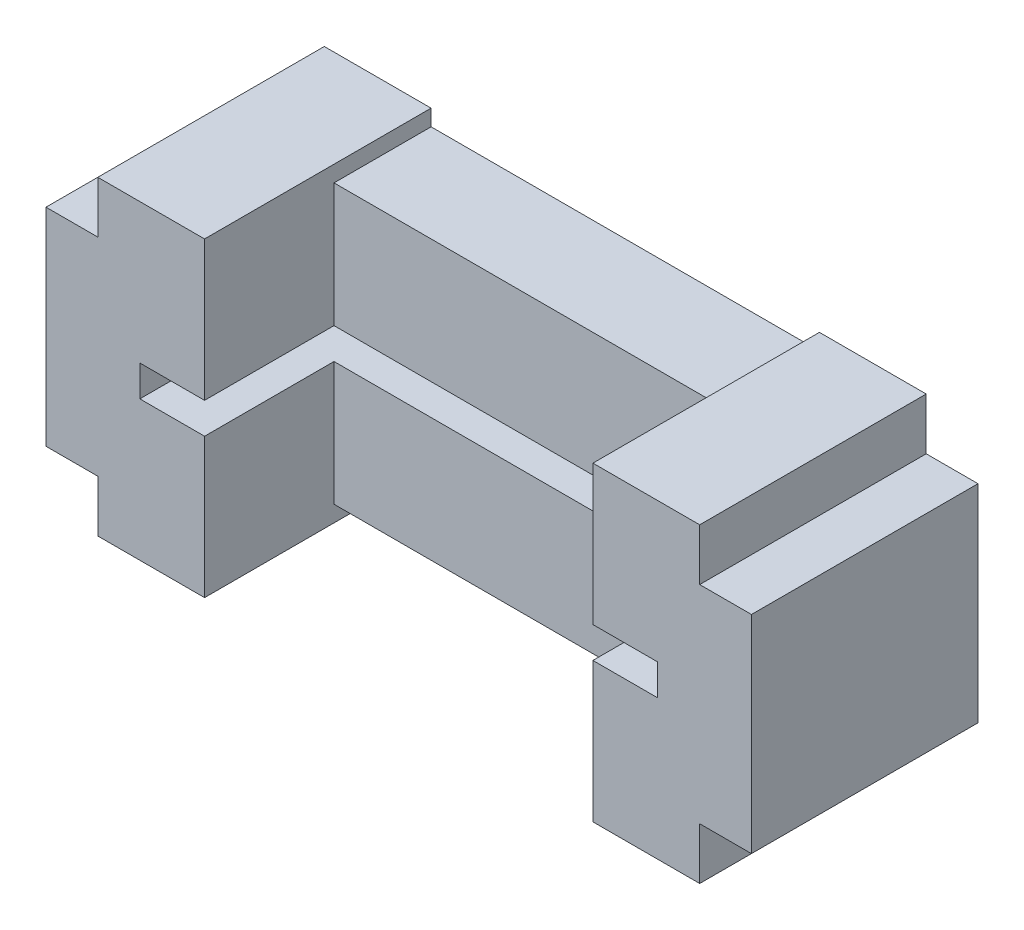
from build123d import *

# Parameters (mm, degrees)
BOSS_EXTRUDE1_DEPTH     = 9.525
BOSS_EXTRUDE2_DEPTH     = 12.7
SKETCH4_W               = 50.8
SKETCH4_H               = 3.048
CUT_EXTRUDE1_DEPTH      = 6.096
CUT_EXTRUDE2_DEPTH      = 40.890182454
CUT_EXTRUDE2_DEPTH_BACK = 40.890182454
SKETCH5_W               = 38.1
SKETCH5_H               = 1.5875


with BuildPart() as part:
    # Sketch1 → Boss-Extrude1 (new body)
    with BuildSketch(Plane.XY):
        Polygon((-29.5275, -15.24), (29.5275, -15.24), (29.5275, -10.16), (34.6075, -10.16), (34.6075, 10.16), (29.5275, 10.16), (29.5275, 15.24), (-29.5275, 15.24), (-29.5275, 10.16), (-34.6075, 10.16), (-34.6075, -10.16), (-29.5275, -10.16), align=None)
    extrude(amount=BOSS_EXTRUDE1_DEPTH)

    # Sketch3 → Boss-Extrude2 (add)
    with BuildSketch(Plane.XY.offset(9.525)):
        Polygon((-29.5275, 15.24), (-19.05, 15.24), (-19.05, 1.524), (-25.4, 1.524), (-25.4, -1.524), (-19.05, -1.524), (-19.05, -15.24), (-29.5275, -15.24), (-29.5275, -10.16), (-34.6075, -10.16), (-34.6075, 10.16), (-29.5275, 10.16), align=None)
        Polygon((19.05, -1.524), (19.05, -15.24), (29.5275, -15.24), (29.5275, -10.16), (34.6075, -10.16), (34.6075, 10.16), (29.5275, 10.16), (29.5275, 15.24), (19.05, 15.24), (19.05, 1.524), (25.4, 1.524), (25.4, -1.524), align=None)
    extrude(amount=BOSS_EXTRUDE2_DEPTH)

    # Sketch4 → Cut-Extrude1 (cut)
    with BuildSketch(Plane.XY.offset(9.525)):
        Rectangle(SKETCH4_W, SKETCH4_H)
    extrude(amount=-CUT_EXTRUDE1_DEPTH, mode=Mode.SUBTRACT)

    # Sketch5 → Cut-Extrude2 (cut, two sides: drawn at the far end of the back side and taken through both)
    with BuildSketch(Plane.XY.offset(9.525).offset(-CUT_EXTRUDE2_DEPTH_BACK)):
        with Locations((0, 14.44625)):
            Rectangle(SKETCH5_W, SKETCH5_H)
        with Locations((0, -14.44625)):
            Rectangle(SKETCH5_W, SKETCH5_H)
    extrude(amount=CUT_EXTRUDE2_DEPTH + CUT_EXTRUDE2_DEPTH_BACK, mode=Mode.SUBTRACT)


solid = part.part
